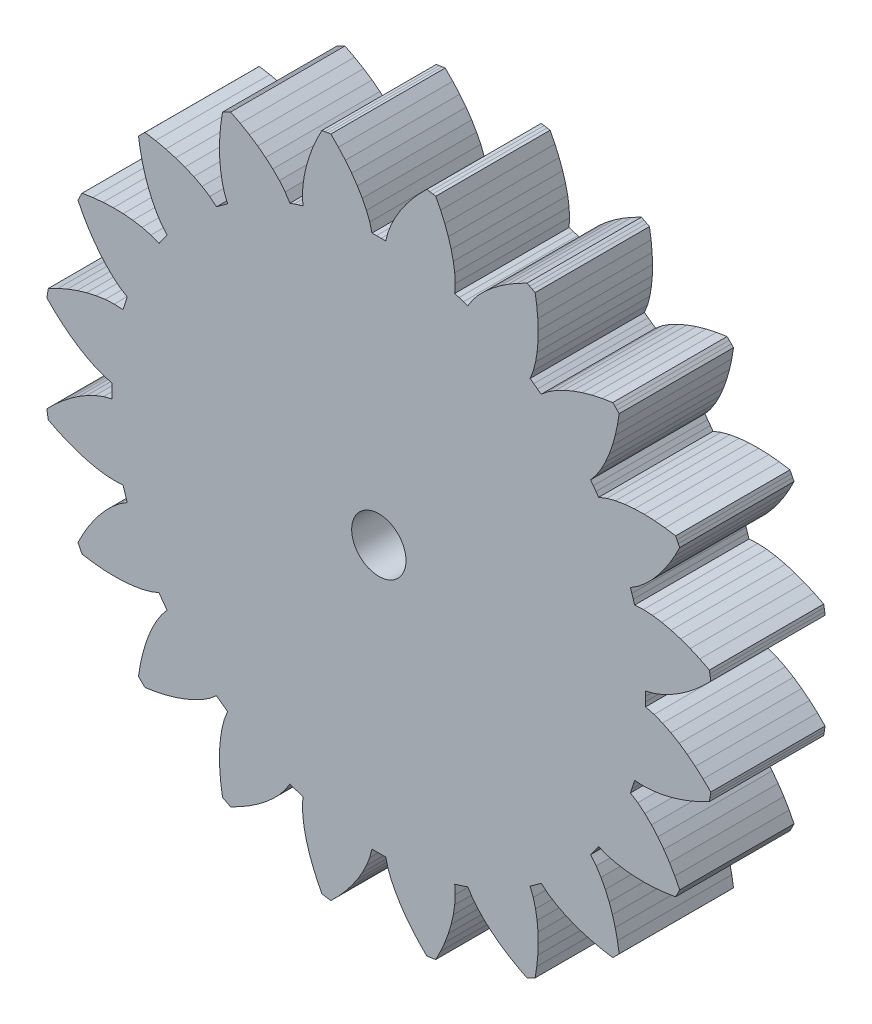
from build123d import *

# Parameters (mm, degrees)
SKETCH_1_R      = 3.560918418
EXTRUDE_1_DEPTH = 15


with BuildPart() as part:
    # 草图1 → 凸台-拉伸1 (new body)
    with BuildSketch(Plane.XY):
        Polygon((34.988371512, 0.902141317), (36.105342125, 1.19159349), (37.214523779, 1.625336863), (38.313449016, 2.172613519), (39.39918395, 2.820337579), (40.468635819, 3.560918418), (41.518633074, 4.389260489), (42.545960131, 5.301594246), (43.547377091, 6.294914497), (43.488867252, 6.687183646), (43.426823978, 7.078909465), (43.361252307, 7.470060129), (42.101895344, 8.105308968), (40.842922617, 8.655528413), (39.588344108, 9.118861542), (38.342382874, 9.492716973), (37.109629848, 9.773228615), (35.895372053, 9.954133071), (34.70644354, 10.023891551), (33.554695719, 9.954014025), (33.378684008, 10.529171566), (33.192814378, 11.101219467), (32.997141723, 11.669988781), (33.969998262, 12.290437058), (34.890858628, 13.0457075), (35.766880849, 13.905785103), (36.599318391, 14.857317838), (37.387575494, 15.892130872), (38.130210449, 17.004397993), (38.825329905, 18.189540477), (39.470781192, 19.443699034), (39.293917196, 19.798688629), (39.113860599, 20.152069596), (38.930626033, 20.503813223), (37.536603699, 20.718808067), (36.169222324, 20.853053888), (34.832869447, 20.906023799), (33.532362215, 20.876558247), (32.273261552, 20.762399037), (31.062531213, 20.559223105), (29.910236447, 20.258168246), (28.83645252, 19.83580112), (28.491321981, 20.328417838), (28.137776935, 20.815030847), (27.775921797, 21.295496433), (28.509434287, 22.186207014), (29.151833137, 23.189073392), (29.719201182, 24.277761555), (30.216856545, 25.439960309), (30.646758786, 26.66771083), (31.009337156, 27.955026545), (31.304205877, 29.296967752), (31.530510221, 30.689198836), (31.252604747, 30.972160024), (30.972160024, 31.252604747), (30.689198836, 31.530510221), (29.296967752, 31.304205877), (27.955026545, 31.009337156), (26.66771083, 30.646758786), (25.439960309, 30.216856545), (24.277761555, 29.719201182), (23.189073392, 29.151833137), (22.186207014, 28.509434287), (21.295496433, 27.775921797), (20.815030847, 28.137776935), (20.328417838, 28.491321981), (19.83580112, 28.83645252), (20.258168246, 29.910236447), (20.559223105, 31.062531213), (20.762399037, 32.273261552), (20.876558247, 33.532362215), (20.906023799, 34.832869447), (20.853053888, 36.169222324), (20.718808067, 37.536603699), (20.503813223, 38.930626033), (20.152069596, 39.113860599), (19.798688629, 39.293917196), (19.443699034, 39.470781192), (18.189540477, 38.825329905), (17.004397993, 38.130210449), (15.892130872, 37.387575494), (14.857317838, 36.599318391), (13.905785103, 35.766880849), (13.0457075, 34.890858628), (12.290437058, 33.969998262), (11.669988781, 32.997141723), (11.101219467, 33.192814378), (10.529171566, 33.378684008), (9.954014025, 33.554695719), (10.023891551, 34.70644354), (9.954133071, 35.895372053), (9.773228615, 37.109629848), (9.492716973, 38.342382874), (9.118861542, 39.588344108), (8.655528413, 40.842922617), (8.105308968, 42.101895344), (7.470060129, 43.361252307), (7.078909465, 43.426823978), (6.687183646, 43.488867252), (6.294914497, 43.547377091), (5.301594246, 42.545960131), (4.389260489, 41.518633074), (3.560918418, 40.468635819), (2.820337579, 39.39918395), (2.172613519, 38.313449016), (1.625336863, 37.214523779), (1.19159349, 36.105342125), (0.902141317, 34.988371512), (0.300743379, 34.998707882), (-0.300743379, 34.998707882), (-0.902141317, 34.988371512), (-1.19159349, 36.105342125), (-1.625336863, 37.214523779), (-2.172613519, 38.313449016), (-2.820337579, 39.39918395), (-3.560918418, 40.468635819), (-4.389260489, 41.518633074), (-5.301594246, 42.545960131), (-6.294914497, 43.547377091), (-6.687183646, 43.488867252), (-7.078909465, 43.426823978), (-7.470060129, 43.361252307), (-8.105308968, 42.101895344), (-8.655528413, 40.842922617), (-9.118861542, 39.588344108), (-9.492716973, 38.342382874), (-9.773228615, 37.109629848), (-9.954133071, 35.895372053), (-10.023891551, 34.70644354), (-9.954014025, 33.554695719), (-10.529171566, 33.378684008), (-11.101219467, 33.192814378), (-11.669988781, 32.997141723), (-12.290437058, 33.969998262), (-13.0457075, 34.890858628), (-13.905785103, 35.766880849), (-14.857317838, 36.599318391), (-15.892130872, 37.387575494), (-17.004397993, 38.130210449), (-18.189540477, 38.825329905), (-19.443699034, 39.470781192), (-19.798688629, 39.293917196), (-20.152069596, 39.113860599), (-20.503813223, 38.930626033), (-20.718808067, 37.536603699), (-20.853053888, 36.169222324), (-20.906023799, 34.832869447), (-20.876558247, 33.532362215), (-20.762399037, 32.273261552), (-20.559223105, 31.062531213), (-20.258168246, 29.910236447), (-19.83580112, 28.83645252), (-20.328417838, 28.491321981), (-20.815030847, 28.137776935), (-21.295496433, 27.775921797), (-22.186207014, 28.509434287), (-23.189073392, 29.151833137), (-24.277761555, 29.719201182), (-25.439960309, 30.216856545), (-26.66771083, 30.646758786), (-27.955026545, 31.009337156), (-29.296967752, 31.304205877), (-30.689198836, 31.530510221), (-30.972160024, 31.252604747), (-31.252604747, 30.972160024), (-31.530510221, 30.689198836), (-31.304205877, 29.296967752), (-31.009337156, 27.955026545), (-30.646758786, 26.66771083), (-30.216856545, 25.439960309), (-29.719201182, 24.277761555), (-29.151833137, 23.189073392), (-28.509434287, 22.186207014), (-27.775921797, 21.295496433), (-28.137776935, 20.815030847), (-28.491321981, 20.328417838), (-28.83645252, 19.83580112), (-29.910236447, 20.258168246), (-31.062531213, 20.559223105), (-32.273261552, 20.762399037), (-33.532362215, 20.876558247), (-34.832869447, 20.906023799), (-36.169222324, 20.853053888), (-37.536603699, 20.718808067), (-38.930626033, 20.503813223), (-39.113860599, 20.152069596), (-39.293917196, 19.798688629), (-39.470781192, 19.443699034), (-38.825329905, 18.189540477), (-38.130210449, 17.004397993), (-37.387575494, 15.892130872), (-36.599318391, 14.857317838), (-35.766880849, 13.905785103), (-34.890858628, 13.0457075), (-33.969998262, 12.290437058), (-32.997141723, 11.669988781), (-33.192814378, 11.101219467), (-33.378684008, 10.529171566), (-33.554695719, 9.954014025), (-34.70644354, 10.023891551), (-35.895372053, 9.954133071), (-37.109629848, 9.773228615), (-38.342382874, 9.492716973), (-39.588344108, 9.118861542), (-40.842922617, 8.655528413), (-42.101895344, 8.105308968), (-43.361252307, 7.470060129), (-43.426823978, 7.078909465), (-43.488867252, 6.687183646), (-43.547377091, 6.294914497), (-42.545960131, 5.301594246), (-41.518633074, 4.389260489), (-40.468635819, 3.560918418), (-39.39918395, 2.820337579), (-38.313449016, 2.172613519), (-37.214523779, 1.625336863), (-36.105342125, 1.19159349), (-34.988371512, 0.902141317), (-34.998707882, 0.300743379), (-34.998707882, -0.300743379), (-34.988371512, -0.902141317), (-36.105342125, -1.19159349), (-37.214523779, -1.625336863), (-38.313449016, -2.172613519), (-39.39918395, -2.820337579), (-40.468635819, -3.560918418), (-41.518633074, -4.389260489), (-42.545960131, -5.301594246), (-43.547377091, -6.294914497), (-43.488867252, -6.687183646), (-43.426823978, -7.078909465), (-43.361252307, -7.470060129), (-42.101895344, -8.105308968), (-40.842922617, -8.655528413), (-39.588344108, -9.118861542), (-38.342382874, -9.492716973), (-37.109629848, -9.773228615), (-35.895372053, -9.954133071), (-34.70644354, -10.023891551), (-33.554695719, -9.954014025), (-33.378684008, -10.529171566), (-33.192814378, -11.101219467), (-32.997141723, -11.669988781), (-33.969998262, -12.290437058), (-34.890858628, -13.0457075), (-35.766880849, -13.905785103), (-36.599318391, -14.857317838), (-37.387575494, -15.892130872), (-38.130210449, -17.004397993), (-38.825329905, -18.189540477), (-39.470781192, -19.443699034), (-39.293917196, -19.798688629), (-39.113860599, -20.152069596), (-38.930626033, -20.503813223), (-37.536603699, -20.718808067), (-36.169222324, -20.853053888), (-34.832869447, -20.906023799), (-33.532362215, -20.876558247), (-32.273261552, -20.762399037), (-31.062531213, -20.559223105), (-29.910236447, -20.258168246), (-28.83645252, -19.83580112), (-28.491321981, -20.328417838), (-28.137776935, -20.815030847), (-27.775921797, -21.295496433), (-28.509434287, -22.186207014), (-29.151833137, -23.189073392), (-29.719201182, -24.277761555), (-30.216856545, -25.439960309), (-30.646758786, -26.66771083), (-31.009337156, -27.955026545), (-31.304205877, -29.296967752), (-31.530510221, -30.689198836), (-31.252604747, -30.972160024), (-30.972160024, -31.252604747), (-30.689198836, -31.530510221), (-29.296967752, -31.304205877), (-27.955026545, -31.009337156), (-26.66771083, -30.646758786), (-25.439960309, -30.216856545), (-24.277761555, -29.719201182), (-23.189073392, -29.151833137), (-22.186207014, -28.509434287), (-21.295496433, -27.775921797), (-20.815030847, -28.137776935), (-20.328417838, -28.491321981), (-19.83580112, -28.83645252), (-20.258168246, -29.910236447), (-20.559223105, -31.062531213), (-20.762399037, -32.273261552), (-20.876558247, -33.532362215), (-20.906023799, -34.832869447), (-20.853053888, -36.169222324), (-20.718808067, -37.536603699), (-20.503813223, -38.930626033), (-20.152069596, -39.113860599), (-19.798688629, -39.293917196), (-19.443699034, -39.470781192), (-18.189540477, -38.825329905), (-17.004397993, -38.130210449), (-15.892130872, -37.387575494), (-14.857317838, -36.599318391), (-13.905785103, -35.766880849), (-13.0457075, -34.890858628), (-12.290437058, -33.969998262), (-11.669988781, -32.997141723), (-11.101219467, -33.192814378), (-10.529171566, -33.378684008), (-9.954014025, -33.554695719), (-10.023891551, -34.70644354), (-9.954133071, -35.895372053), (-9.773228615, -37.109629848), (-9.492716973, -38.342382874), (-9.118861542, -39.588344108), (-8.655528413, -40.842922617), (-8.105308968, -42.101895344), (-7.470060129, -43.361252307), (-7.078909465, -43.426823978), (-6.687183646, -43.488867252), (-6.294914497, -43.547377091), (-5.301594246, -42.545960131), (-4.389260489, -41.518633074), (-3.560918418, -40.468635819), (-2.820337579, -39.39918395), (-2.172613519, -38.313449016), (-1.625336863, -37.214523779), (-1.19159349, -36.105342125), (-0.902141317, -34.988371512), (-0.300743379, -34.998707882), (0.300743379, -34.998707882), (0.902141317, -34.988371512), (1.19159349, -36.105342125), (1.625336863, -37.214523779), (2.172613519, -38.313449016), (2.820337579, -39.39918395), (3.560918418, -40.468635819), (4.389260489, -41.518633074), (5.301594246, -42.545960131), (6.294914497, -43.547377091), (6.687183646, -43.488867252), (7.078909465, -43.426823978), (7.470060129, -43.361252307), (8.105308968, -42.101895344), (8.655528413, -40.842922617), (9.118861542, -39.588344108), (9.492716973, -38.342382874), (9.773228615, -37.109629848), (9.954133071, -35.895372053), (10.023891551, -34.70644354), (9.954014025, -33.554695719), (10.529171566, -33.378684008), (11.101219467, -33.192814378), (11.669988781, -32.997141723), (12.290437058, -33.969998262), (13.0457075, -34.890858628), (13.905785103, -35.766880849), (14.857317838, -36.599318391), (15.892130872, -37.387575494), (17.004397993, -38.130210449), (18.189540477, -38.825329905), (19.443699034, -39.470781192), (19.798688629, -39.293917196), (20.152069596, -39.113860599), (20.503813223, -38.930626033), (20.718808067, -37.536603699), (20.853053888, -36.169222324), (20.906023799, -34.832869447), (20.876558247, -33.532362215), (20.762399037, -32.273261552), (20.559223105, -31.062531213), (20.258168246, -29.910236447), (19.83580112, -28.83645252), (20.328417838, -28.491321981), (20.815030847, -28.137776935), (21.295496433, -27.775921797), (22.186207014, -28.509434287), (23.189073392, -29.151833137), (24.277761555, -29.719201182), (25.439960309, -30.216856545), (26.66771083, -30.646758786), (27.955026545, -31.009337156), (29.296967752, -31.304205877), (30.689198836, -31.530510221), (30.972160024, -31.252604747), (31.252604747, -30.972160024), (31.530510221, -30.689198836), (31.304205877, -29.296967752), (31.009337156, -27.955026545), (30.646758786, -26.66771083), (30.216856545, -25.439960309), (29.719201182, -24.277761555), (29.151833137, -23.189073392), (28.509434287, -22.186207014), (27.775921797, -21.295496433), (28.137776935, -20.815030847), (28.491321981, -20.328417838), (28.83645252, -19.83580112), (29.910236447, -20.258168246), (31.062531213, -20.559223105), (32.273261552, -20.762399037), (33.532362215, -20.876558247), (34.832869447, -20.906023799), (36.169222324, -20.853053888), (37.536603699, -20.718808067), (38.930626033, -20.503813223), (39.113860599, -20.152069596), (39.293917196, -19.798688629), (39.470781192, -19.443699034), (38.825329905, -18.189540477), (38.130210449, -17.004397993), (37.387575494, -15.892130872), (36.599318391, -14.857317838), (35.766880849, -13.905785103), (34.890858628, -13.0457075), (33.969998262, -12.290437058), (32.997141723, -11.669988781), (33.192814378, -11.101219467), (33.378684008, -10.529171566), (33.554695719, -9.954014025), (34.70644354, -10.023891551), (35.895372053, -9.954133071), (37.109629848, -9.773228615), (38.342382874, -9.492716973), (39.588344108, -9.118861542), (40.842922617, -8.655528413), (42.101895344, -8.105308968), (43.361252307, -7.470060129), (43.426823978, -7.078909465), (43.488867252, -6.687183646), (43.547377091, -6.294914497), (42.545960131, -5.301594246), (41.518633074, -4.389260489), (40.468635819, -3.560918418), (39.39918395, -2.820337579), (38.313449016, -2.172613519), (37.214523779, -1.625336863), (36.105342125, -1.19159349), (34.988371512, -0.902141317), (34.998707882, -0.300743379), (34.998707882, 0.300743379), align=None)
        Circle(SKETCH_1_R, mode=Mode.SUBTRACT)
    extrude(amount=EXTRUDE_1_DEPTH)


solid = part.part
